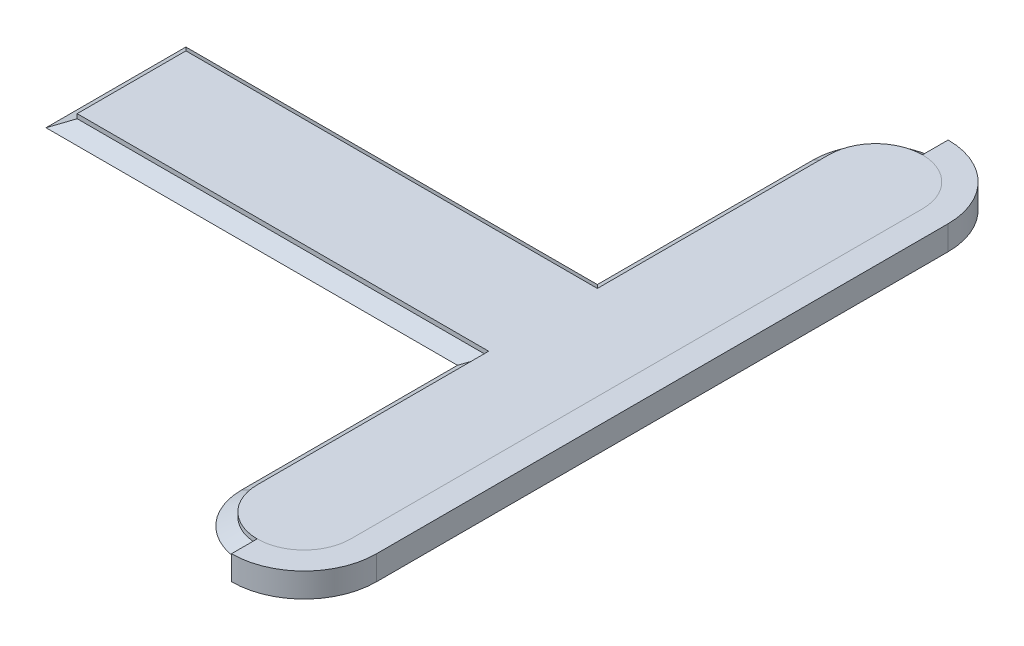
from build123d import *

# Parameters (mm, degrees)
BOSS_EXTRUDE1_DEPTH = 6
BOSS_EXTRUDE2_DEPTH = 6


with BuildPart() as part:
    # Sketch1 → Boss-Extrude1 (new body)
    with BuildSketch(Plane(origin=(0, 0, 0), x_dir=(1, 0, 0), z_dir=(0, 1, 0))):
        with BuildLine():
            Line((0, -13.421553628), (101.6, -13.421553628))
            Line((101.6, -13.421553628), (101.6, -70.571553628))
            ThreePointArc((101.6, -70.571553628), (113.157, -82.128553628), (124.714, -70.571553628))
            Line((124.714, -70.571553628), (124.714, 70.571553628))
            ThreePointArc((124.714, 70.571553628), (113.157, 82.128553628), (101.6, 70.571553628))
            Line((101.6, 70.571553628), (101.6, 13.421553628))
            Line((101.6, 13.421553628), (0, 13.421553628))
            Line((0, 13.421553628), (0, -13.421553628))
        make_face()
    extrude(amount=BOSS_EXTRUDE1_DEPTH)

    # Sweep1: sweep along a curve in space
    with BuildLine() as sweep1_path:
        ThreePointArc((113.157, 3, 82.128553628), (104.98496693, 3, 78.743586698), (101.6, 3, 70.571553628))
        Line((101.6, 3, 70.571553628), (101.6, 3, 13.421553628))
        Line((101.6, 3, 13.421553628), (0, 3, 13.421553628))
        Line((0, 3, 13.421553628), (0, 3, -13.421553628))
        Line((0, 3, -13.421553628), (101.6, 3, -13.421553628))
        Line((101.6, 3, -13.421553628), (101.6, 3, -70.571553628))
        ThreePointArc((101.6, 3, -70.571553628), (104.98496693, 3, -78.743586698), (113.157, 3, -82.128553628))
    # Sketch4 → Sweep1 (sweep)
    with BuildSketch(Plane(origin=(113.157, 0, 0), x_dir=(0, 0, -1), z_dir=(1, 0, 0))):
        Polygon((82.128553628, 4.910343042), (82.128553628, 1.060343042), (85.978553628, 2.985343042), align=None)
    sweep(path=sweep1_path.line, transition=Transition.RIGHT)


with BuildPart() as body_2:
    # Sketch5 → Boss-Extrude2 (new body)
    with BuildSketch(Plane(origin=(0, 6, 0), x_dir=(1, 0, 0), z_dir=(0, 1, 0))):
        with BuildLine():
            Line((131.064, -70.571553628), (131.064, 70.571553628))
            ThreePointArc((131.064, 70.571553628), (125.819161131, 83.233714759), (113.157, 88.478553628))
            Line((113.157, 88.478553628), (113.157, 82.128553628))
            ThreePointArc((113.157, 82.128553628), (121.32903307, 78.743586698), (124.714, 70.571553628))
            Line((124.714, 70.571553628), (124.714, -70.571553628))
            ThreePointArc((124.714, -70.571553628), (121.32903307, -78.743586698), (113.157, -82.128553628))
            Line((113.157, -82.128553628), (113.157, -88.478553628))
            ThreePointArc((113.157, -88.478553628), (125.819161131, -83.233714759), (131.064, -70.571553628))
        make_face()
    extrude(amount=-BOSS_EXTRUDE2_DEPTH)


solid = Compound([part.part, body_2.part])
